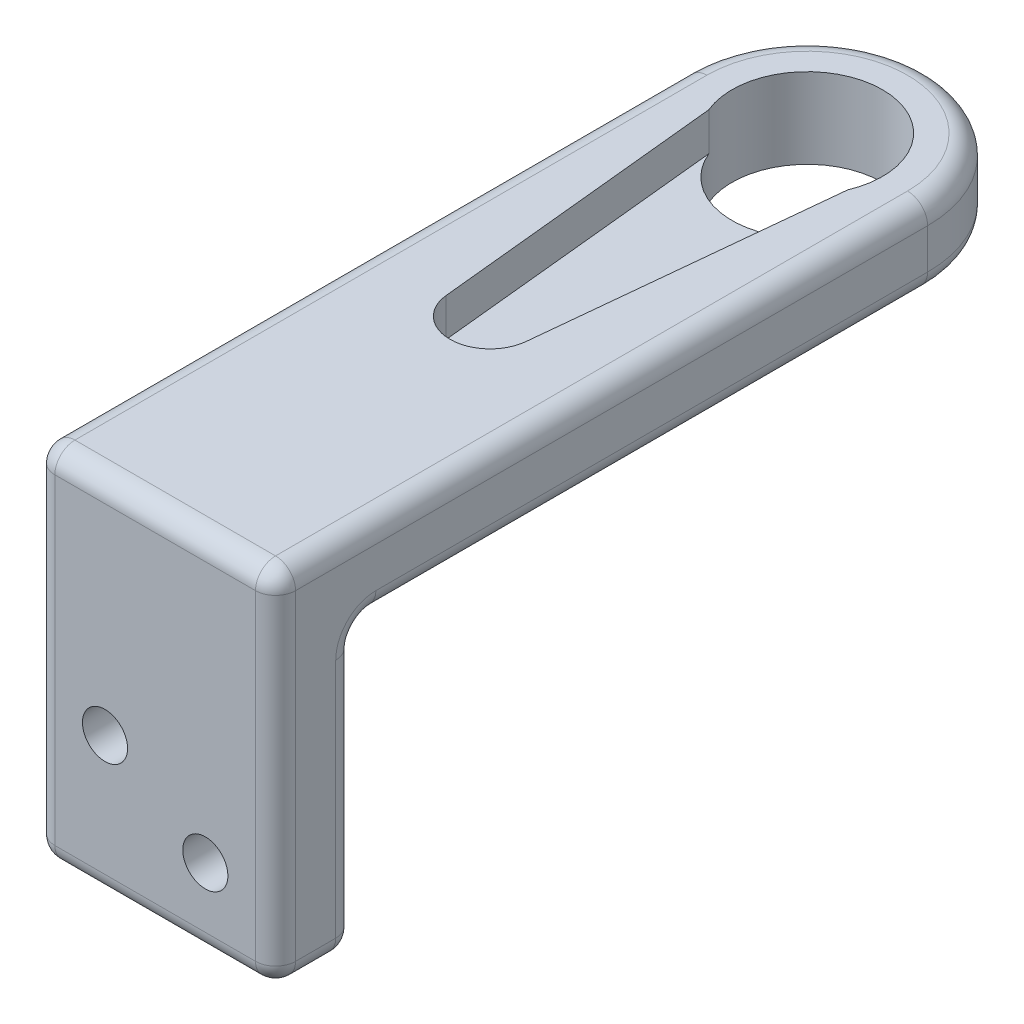
from build123d import *

# Parameters (mm, degrees)
YAW_ARM_BASE_DEPTH           = 4
YAW_ARM_MOUNTING_HOLE_REACH  = 35.29
SKETCH2_R                    = 3.75
YAW_ARM_SLOT_DEPTH           = 1.9
SKETCH5_W                    = 12
SKETCH5_H                    = 4
MOUNTING_BRACKET_DEPTH       = 14
BRACKET_MOUNTING_HOLES_REACH = 39.713
SKETCH8_R                    = 1.125
F_1MM_FILLETS_R              = 1


with BuildPart() as part:
    # Sketch1 → Yaw Arm Base (new body)
    with BuildSketch(Plane(origin=(0, 0, 0), x_dir=(1, 0, 0), z_dir=(0, 1, 0))):
        with BuildLine():
            Line((-6, 0), (-6, -32.5))
            Line((-6, -32.5), (6, -32.5))
            Line((6, -32.5), (6, 0))
            ThreePointArc((6, 0), (0, 6), (-6, 0))
        make_face()
    extrude(amount=YAW_ARM_BASE_DEPTH)

    # Sketch2 → Yaw Arm Mounting Hole (cut, up to next)
    with BuildSketch(Plane(origin=(0, 4, 0), x_dir=(1, 0, 0), z_dir=(0, 1, 0)), mode=Mode.PRIVATE) as yaw_arm_mounting_hole_sk1:
        with Locations(Location((0, 0, 0), (0, 0, 270))):
            Circle(SKETCH2_R)
    yaw_arm_mounting_hole_tool1 = extrude(yaw_arm_mounting_hole_sk1.sketch, amount=-YAW_ARM_MOUNTING_HOLE_REACH, mode=Mode.PRIVATE) & part.part
    add(yaw_arm_mounting_hole_tool1.solids().sort_by_distance((0, 4, 0))[0], mode=Mode.SUBTRACT)

    # Sketch4 → Yaw Arm Slot (cut)
    with BuildSketch(Plane(origin=(0, 4, 0), x_dir=(1, 0, 0), z_dir=(0, 1, 0))):
        with BuildLine():
            Line((-3.46, -1.445994467), (-1.989882432, -16.005994467))
            ThreePointArc((-1.989882432, -16.005994467), (0, -17.805076808), (1.989882432, -16.005994467))
            Line((1.989882432, -16.005994467), (3.46, -1.445994467))
            ThreePointArc((3.46, -1.445994467), (0, -3.75), (-3.46, -1.445994467))
        make_face()
    extrude(amount=-YAW_ARM_SLOT_DEPTH, mode=Mode.SUBTRACT)

    # Sketch5 → Mounting Bracket (add)
    with BuildSketch(Plane.XZ):
        with Locations((0, 30.5)):
            Rectangle(SKETCH5_W, SKETCH5_H)
    extrude(amount=MOUNTING_BRACKET_DEPTH)

    # Sketch8 → Bracket Mounting Holes (cut, up to next)
    with BuildSketch(Plane(origin=(0, 0, 28.5), x_dir=(-1, 0, 0), z_dir=(0, 0, -1)), mode=Mode.PRIVATE) as bracket_mounting_holes_sk1:
        with Locations((-2.5, -10)):
            Circle(SKETCH8_R)
    bracket_mounting_holes_tool1 = extrude(bracket_mounting_holes_sk1.sketch, amount=-BRACKET_MOUNTING_HOLES_REACH, mode=Mode.PRIVATE) & part.part
    # Sketch8 → Bracket Mounting Holes (cut, up to next)
    with BuildSketch(Plane(origin=(0, 0, 28.5), x_dir=(-1, 0, 0), z_dir=(0, 0, -1)), mode=Mode.PRIVATE) as bracket_mounting_holes_sk2:
        with Locations((2.5, -7)):
            Circle(SKETCH8_R)
    bracket_mounting_holes_tool2 = extrude(bracket_mounting_holes_sk2.sketch, amount=-BRACKET_MOUNTING_HOLES_REACH, mode=Mode.PRIVATE) & part.part
    add(bracket_mounting_holes_tool1.solids().sort_by_distance((2.5, -10, 28.5))[0], mode=Mode.SUBTRACT)
    add(bracket_mounting_holes_tool2.solids().sort_by_distance((-2.5, -7, 28.5))[0], mode=Mode.SUBTRACT)

    # 1mm Fillets
    f_1mm_fillets_edges = [part.edges().sort_by_distance(p)[0] for p in [
        (0, 4, 32.5),
        (6, 4, 16.25),
        (6, 0, 14.25),
        (0, 0, 28.5),
        (-6, -7, 28.5),
        (6, -7, 28.5),
        (-6, -14, 30.5),
        (0, -14, 28.5),
        (6, -14, 30.5),
        (0, -14, 32.5),
        (0, 4, -6),
        (-6, 0, 14.25),
        (0, 0, -6),
        (6, -5, 32.5),
        (-6, -5, 32.5),
        (-6, 4, 16.25),
    ]]
    fillet(f_1mm_fillets_edges, radius=F_1MM_FILLETS_R)


solid = part.part
